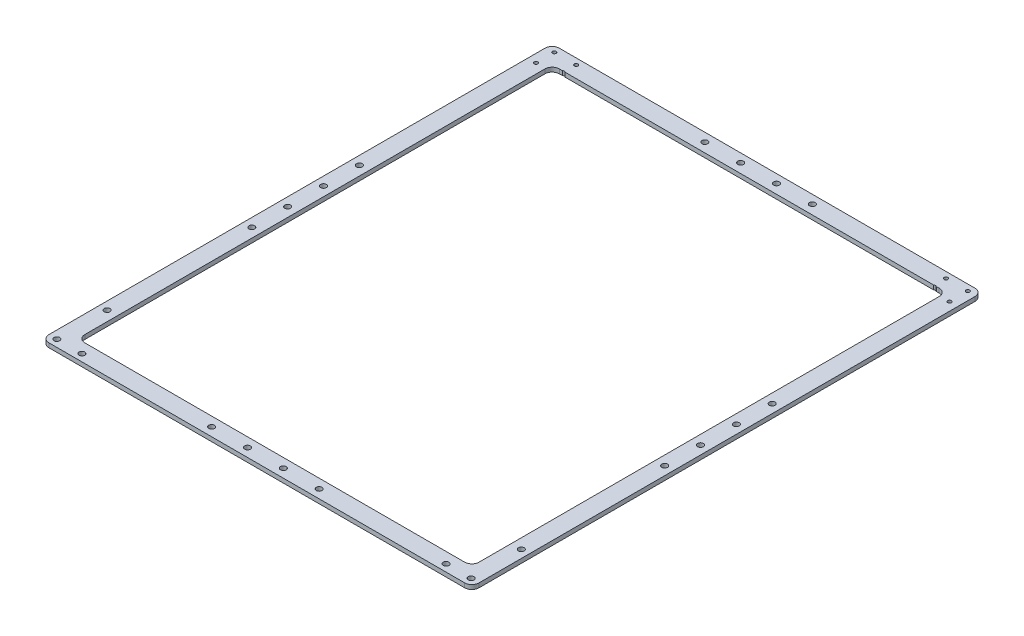
from build123d import *

# Parameters (mm, degrees)
SKETCH1_W                = 600
SKETCH1_H                = 730
BOSS_EXTRUDE1_DEPTH      = 6
SKETCH2_R                = 2.75
CUT_EXTRUDE1_DEPTH       = 473.505026428
LPATTERN1_COUNT          = 25
LPATTERN1_PITCH          = 25
MIRROR2_COPY_1_SKETCH_R  = 2.75
MIRROR2_COPY_1_DEPTH     = 473.505026428
MIRROR2_COPY_2_SKETCH_R  = 2.75
MIRROR2_COPY_2_DEPTH     = 473.505026428
MIRROR2_COPY_3_SKETCH_R  = 2.75
MIRROR2_COPY_3_DEPTH     = 473.505026428
MIRROR2_COPY_4_SKETCH_R  = 2.75
MIRROR2_COPY_4_DEPTH     = 473.505026428
MIRROR2_COPY_5_SKETCH_R  = 2.75
MIRROR2_COPY_5_DEPTH     = 473.505026428
MIRROR2_COPY_6_SKETCH_R  = 2.75
MIRROR2_COPY_6_DEPTH     = 473.505026428
MIRROR2_COPY_7_SKETCH_R  = 2.75
MIRROR2_COPY_7_DEPTH     = 473.505026428
MIRROR2_COPY_8_SKETCH_R  = 2.75
MIRROR2_COPY_8_DEPTH     = 473.505026428
MIRROR2_COPY_9_SKETCH_R  = 2.75
MIRROR2_COPY_9_DEPTH     = 473.505026428
MIRROR2_COPY_10_SKETCH_R = 2.75
MIRROR2_COPY_10_DEPTH    = 473.505026428
MIRROR2_COPY_11_SKETCH_R = 2.75
MIRROR2_COPY_11_DEPTH    = 473.505026428
MIRROR2_COPY_12_SKETCH_R = 2.75
MIRROR2_COPY_12_DEPTH    = 473.505026428
MIRROR2_COPY_13_SKETCH_R = 2.75
MIRROR2_COPY_13_DEPTH    = 473.505026428
MIRROR2_COPY_14_SKETCH_R = 2.75
MIRROR2_COPY_14_DEPTH    = 473.505026428
MIRROR2_COPY_15_SKETCH_R = 2.75
MIRROR2_COPY_15_DEPTH    = 473.505026428
MIRROR2_COPY_16_SKETCH_R = 2.75
MIRROR2_COPY_16_DEPTH    = 473.505026428
MIRROR2_COPY_17_SKETCH_R = 2.75
MIRROR2_COPY_17_DEPTH    = 473.505026428
MIRROR2_COPY_18_SKETCH_R = 2.75
MIRROR2_COPY_18_DEPTH    = 473.505026428
MIRROR2_COPY_19_SKETCH_R = 2.75
MIRROR2_COPY_19_DEPTH    = 473.505026428
MIRROR2_COPY_20_SKETCH_R = 2.75
MIRROR2_COPY_20_DEPTH    = 473.505026428
MIRROR2_COPY_21_SKETCH_R = 2.75
MIRROR2_COPY_21_DEPTH    = 473.505026428
MIRROR2_COPY_22_SKETCH_R = 2.75
MIRROR2_COPY_22_DEPTH    = 473.505026428
MIRROR2_COPY_23_SKETCH_R = 2.75
MIRROR2_COPY_23_DEPTH    = 473.505026428
MIRROR2_COPY_24_SKETCH_R = 2.75
MIRROR2_COPY_24_DEPTH    = 473.505026428
SKETCH3_R                = 4
CUT_EXTRUDE2_DEPTH       = 13
SKETCH5_R                = 2.55
CUT_EXTRUDE4_DEPTH       = 473.505026428
SKETCH6_W                = 600
SKETCH6_H                = 18
CUT_EXTRUDE5_DEPTH       = 6
CUT_EXTRUDE6_REACH       = 474.505
SKETCH7_R                = 4
CUT_EXTRUDE7_REACH       = 474.505
SKETCH8_R                = 4
CUT_EXTRUDE8_REACH       = 474.505
SKETCH9_W                = 550
SKETCH9_H                = 662
FILLET2_R                = 10


with BuildPart() as part:
    # Sketch1 → Boss-Extrude1 (new body)
    with BuildSketch(Plane(origin=(0, 0, 0), x_dir=(1, 0, 0), z_dir=(0, 1, 0))):
        Rectangle(SKETCH1_W, SKETCH1_H)
    extrude(amount=BOSS_EXTRUDE1_DEPTH)

    # Sketch2 → Cut-Extrude1 (cut, through all)
    with BuildSketch(Plane(origin=(0, 6, 0), x_dir=(1, 0, 0), z_dir=(0, 1, 0))):
        with Locations(Location((-259, 320, 0), (0, 0, 270))):
            Circle(SKETCH2_R)
    cut_extrude1 = extrude(amount=-CUT_EXTRUDE1_DEPTH, mode=Mode.SUBTRACT)

    # LPattern1: Cut-Extrude1 ×25
    with Locations(*[(0, 0, i * LPATTERN1_PITCH) for i in range(1, LPATTERN1_COUNT)]):
        add(cut_extrude1, mode=Mode.SUBTRACT)

    # Mirror2: Cut-Extrude1 across plane
    add(cut_extrude1.mirror(Plane(origin=(0, 0, 0), x_dir=(0, 0, 1), z_dir=(1, 0, 0))), mode=Mode.SUBTRACT)

    # Mirror2 copy 1 sketch → Mirror2 copy 1 (cut, through all)
    with BuildSketch(Plane(origin=(0, 6, 25), x_dir=(-1, 0, 0), z_dir=(0, 1, 0))):
        with Locations((-259, -320)):
            Circle(MIRROR2_COPY_1_SKETCH_R)
    extrude(amount=-MIRROR2_COPY_1_DEPTH, mode=Mode.SUBTRACT)

    # Mirror2 copy 2 sketch → Mirror2 copy 2 (cut, through all)
    with BuildSketch(Plane(origin=(0, 6, 50), x_dir=(-1, 0, 0), z_dir=(0, 1, 0))):
        with Locations((-259, -320)):
            Circle(MIRROR2_COPY_2_SKETCH_R)
    extrude(amount=-MIRROR2_COPY_2_DEPTH, mode=Mode.SUBTRACT)

    # Mirror2 copy 3 sketch → Mirror2 copy 3 (cut, through all)
    with BuildSketch(Plane(origin=(0, 6, 75), x_dir=(-1, 0, 0), z_dir=(0, 1, 0))):
        with Locations((-259, -320)):
            Circle(MIRROR2_COPY_3_SKETCH_R)
    extrude(amount=-MIRROR2_COPY_3_DEPTH, mode=Mode.SUBTRACT)

    # Mirror2 copy 4 sketch → Mirror2 copy 4 (cut, through all)
    with BuildSketch(Plane(origin=(0, 6, 100), x_dir=(-1, 0, 0), z_dir=(0, 1, 0))):
        with Locations((-259, -320)):
            Circle(MIRROR2_COPY_4_SKETCH_R)
    extrude(amount=-MIRROR2_COPY_4_DEPTH, mode=Mode.SUBTRACT)

    # Mirror2 copy 5 sketch → Mirror2 copy 5 (cut, through all)
    with BuildSketch(Plane(origin=(0, 6, 125), x_dir=(-1, 0, 0), z_dir=(0, 1, 0))):
        with Locations((-259, -320)):
            Circle(MIRROR2_COPY_5_SKETCH_R)
    extrude(amount=-MIRROR2_COPY_5_DEPTH, mode=Mode.SUBTRACT)

    # Mirror2 copy 6 sketch → Mirror2 copy 6 (cut, through all)
    with BuildSketch(Plane(origin=(0, 6, 150), x_dir=(-1, 0, 0), z_dir=(0, 1, 0))):
        with Locations((-259, -320)):
            Circle(MIRROR2_COPY_6_SKETCH_R)
    extrude(amount=-MIRROR2_COPY_6_DEPTH, mode=Mode.SUBTRACT)

    # Mirror2 copy 7 sketch → Mirror2 copy 7 (cut, through all)
    with BuildSketch(Plane(origin=(0, 6, 175), x_dir=(-1, 0, 0), z_dir=(0, 1, 0))):
        with Locations((-259, -320)):
            Circle(MIRROR2_COPY_7_SKETCH_R)
    extrude(amount=-MIRROR2_COPY_7_DEPTH, mode=Mode.SUBTRACT)

    # Mirror2 copy 8 sketch → Mirror2 copy 8 (cut, through all)
    with BuildSketch(Plane(origin=(0, 6, 200), x_dir=(-1, 0, 0), z_dir=(0, 1, 0))):
        with Locations((-259, -320)):
            Circle(MIRROR2_COPY_8_SKETCH_R)
    extrude(amount=-MIRROR2_COPY_8_DEPTH, mode=Mode.SUBTRACT)

    # Mirror2 copy 9 sketch → Mirror2 copy 9 (cut, through all)
    with BuildSketch(Plane(origin=(0, 6, 225), x_dir=(-1, 0, 0), z_dir=(0, 1, 0))):
        with Locations((-259, -320)):
            Circle(MIRROR2_COPY_9_SKETCH_R)
    extrude(amount=-MIRROR2_COPY_9_DEPTH, mode=Mode.SUBTRACT)

    # Mirror2 copy 10 sketch → Mirror2 copy 10 (cut, through all)
    with BuildSketch(Plane(origin=(0, 6, 250), x_dir=(-1, 0, 0), z_dir=(0, 1, 0))):
        with Locations((-259, -320)):
            Circle(MIRROR2_COPY_10_SKETCH_R)
    extrude(amount=-MIRROR2_COPY_10_DEPTH, mode=Mode.SUBTRACT)

    # Mirror2 copy 11 sketch → Mirror2 copy 11 (cut, through all)
    with BuildSketch(Plane(origin=(0, 6, 275), x_dir=(-1, 0, 0), z_dir=(0, 1, 0))):
        with Locations((-259, -320)):
            Circle(MIRROR2_COPY_11_SKETCH_R)
    extrude(amount=-MIRROR2_COPY_11_DEPTH, mode=Mode.SUBTRACT)

    # Mirror2 copy 12 sketch → Mirror2 copy 12 (cut, through all)
    with BuildSketch(Plane(origin=(0, 6, 300), x_dir=(-1, 0, 0), z_dir=(0, 1, 0))):
        with Locations((-259, -320)):
            Circle(MIRROR2_COPY_12_SKETCH_R)
    extrude(amount=-MIRROR2_COPY_12_DEPTH, mode=Mode.SUBTRACT)

    # Mirror2 copy 13 sketch → Mirror2 copy 13 (cut, through all)
    with BuildSketch(Plane(origin=(0, 6, 325), x_dir=(-1, 0, 0), z_dir=(0, 1, 0))):
        with Locations((-259, -320)):
            Circle(MIRROR2_COPY_13_SKETCH_R)
    extrude(amount=-MIRROR2_COPY_13_DEPTH, mode=Mode.SUBTRACT)

    # Mirror2 copy 14 sketch → Mirror2 copy 14 (cut, through all)
    with BuildSketch(Plane(origin=(0, 6, 350), x_dir=(-1, 0, 0), z_dir=(0, 1, 0))):
        with Locations((-259, -320)):
            Circle(MIRROR2_COPY_14_SKETCH_R)
    extrude(amount=-MIRROR2_COPY_14_DEPTH, mode=Mode.SUBTRACT)

    # Mirror2 copy 15 sketch → Mirror2 copy 15 (cut, through all)
    with BuildSketch(Plane(origin=(0, 6, 375), x_dir=(-1, 0, 0), z_dir=(0, 1, 0))):
        with Locations((-259, -320)):
            Circle(MIRROR2_COPY_15_SKETCH_R)
    extrude(amount=-MIRROR2_COPY_15_DEPTH, mode=Mode.SUBTRACT)

    # Mirror2 copy 16 sketch → Mirror2 copy 16 (cut, through all)
    with BuildSketch(Plane(origin=(0, 6, 400), x_dir=(-1, 0, 0), z_dir=(0, 1, 0))):
        with Locations((-259, -320)):
            Circle(MIRROR2_COPY_16_SKETCH_R)
    extrude(amount=-MIRROR2_COPY_16_DEPTH, mode=Mode.SUBTRACT)

    # Mirror2 copy 17 sketch → Mirror2 copy 17 (cut, through all)
    with BuildSketch(Plane(origin=(0, 6, 425), x_dir=(-1, 0, 0), z_dir=(0, 1, 0))):
        with Locations((-259, -320)):
            Circle(MIRROR2_COPY_17_SKETCH_R)
    extrude(amount=-MIRROR2_COPY_17_DEPTH, mode=Mode.SUBTRACT)

    # Mirror2 copy 18 sketch → Mirror2 copy 18 (cut, through all)
    with BuildSketch(Plane(origin=(0, 6, 450), x_dir=(-1, 0, 0), z_dir=(0, 1, 0))):
        with Locations((-259, -320)):
            Circle(MIRROR2_COPY_18_SKETCH_R)
    extrude(amount=-MIRROR2_COPY_18_DEPTH, mode=Mode.SUBTRACT)

    # Mirror2 copy 19 sketch → Mirror2 copy 19 (cut, through all)
    with BuildSketch(Plane(origin=(0, 6, 475), x_dir=(-1, 0, 0), z_dir=(0, 1, 0))):
        with Locations((-259, -320)):
            Circle(MIRROR2_COPY_19_SKETCH_R)
    extrude(amount=-MIRROR2_COPY_19_DEPTH, mode=Mode.SUBTRACT)

    # Mirror2 copy 20 sketch → Mirror2 copy 20 (cut, through all)
    with BuildSketch(Plane(origin=(0, 6, 500), x_dir=(-1, 0, 0), z_dir=(0, 1, 0))):
        with Locations((-259, -320)):
            Circle(MIRROR2_COPY_20_SKETCH_R)
    extrude(amount=-MIRROR2_COPY_20_DEPTH, mode=Mode.SUBTRACT)

    # Mirror2 copy 21 sketch → Mirror2 copy 21 (cut, through all)
    with BuildSketch(Plane(origin=(0, 6, 525), x_dir=(-1, 0, 0), z_dir=(0, 1, 0))):
        with Locations((-259, -320)):
            Circle(MIRROR2_COPY_21_SKETCH_R)
    extrude(amount=-MIRROR2_COPY_21_DEPTH, mode=Mode.SUBTRACT)

    # Mirror2 copy 22 sketch → Mirror2 copy 22 (cut, through all)
    with BuildSketch(Plane(origin=(0, 6, 550), x_dir=(-1, 0, 0), z_dir=(0, 1, 0))):
        with Locations((-259, -320)):
            Circle(MIRROR2_COPY_22_SKETCH_R)
    extrude(amount=-MIRROR2_COPY_22_DEPTH, mode=Mode.SUBTRACT)

    # Mirror2 copy 23 sketch → Mirror2 copy 23 (cut, through all)
    with BuildSketch(Plane(origin=(0, 6, 575), x_dir=(-1, 0, 0), z_dir=(0, 1, 0))):
        with Locations((-259, -320)):
            Circle(MIRROR2_COPY_23_SKETCH_R)
    extrude(amount=-MIRROR2_COPY_23_DEPTH, mode=Mode.SUBTRACT)

    # Mirror2 copy 24 sketch → Mirror2 copy 24 (cut, through all)
    with BuildSketch(Plane(origin=(0, 6, 600), x_dir=(-1, 0, 0), z_dir=(0, 1, 0))):
        with Locations((-259, -320)):
            Circle(MIRROR2_COPY_24_SKETCH_R)
    extrude(amount=-MIRROR2_COPY_24_DEPTH, mode=Mode.SUBTRACT)

    # Sketch3 → Cut-Extrude2 (cut)
    with BuildSketch(Plane(origin=(0, 6, 0), x_dir=(1, 0, 0), z_dir=(0, 1, 0))):
        with Locations(Location((-289, -285, 0), (0, 0, 270))):
            Circle(SKETCH3_R)
        with Locations(Location((-254, -355, 0), (0, 0, 270))):
            Circle(SKETCH3_R)
        with Locations(Location((-289, -355, 0), (0, 0, 270))):
            Circle(SKETCH3_R)
        with Locations(Location((-236.98, -302.5, 0), (0, 0, 270))):
            Circle(SKETCH3_R)
    cut_extrude2 = extrude(amount=-CUT_EXTRUDE2_DEPTH, mode=Mode.SUBTRACT)

    # Mirror3: Cut-Extrude2 across plane
    add(cut_extrude2.mirror(Plane(origin=(0, 0, 0), x_dir=(0, 0, 1), z_dir=(1, 0, 0))), mode=Mode.SUBTRACT)

    # Sketch5 → Cut-Extrude4 (cut, through all)
    with BuildSketch(Plane(origin=(0, 6, 0), x_dir=(1, 0, 0), z_dir=(0, 1, 0))):
        with Locations(Location((-288.48, 313, 0), (0, 0, 270))):
            Circle(SKETCH5_R)
        with Locations(Location((-257.98, 338.5, 0), (0, 0, 270))):
            Circle(SKETCH5_R)
        with Locations(Location((-288.48, 338.5, 0), (0, 0, 270))):
            Circle(SKETCH5_R)
    cut_extrude4 = extrude(amount=-CUT_EXTRUDE4_DEPTH, mode=Mode.SUBTRACT)

    # Mirror5: Cut-Extrude4 across plane
    add(cut_extrude4.mirror(Plane(origin=(0, 0, 0), x_dir=(0, 0, 1), z_dir=(1, 0, 0))), mode=Mode.SUBTRACT)

    # Sketch6 → Cut-Extrude5 (cut)
    with BuildSketch(Plane(origin=(0, 6, 0), x_dir=(1, 0, 0), z_dir=(0, 1, 0))):
        with Locations((0, 356)):
            Rectangle(SKETCH6_W, SKETCH6_H)
    extrude(amount=-CUT_EXTRUDE5_DEPTH, mode=Mode.SUBTRACT)

    # Sketch7 → Cut-Extrude6 (cut, up to next)
    with BuildSketch(Plane(origin=(0, 6, 0), x_dir=(1, 0, 0), z_dir=(0, 1, 0)), mode=Mode.PRIVATE) as cut_extrude6_sk1:
        with Locations(Location((-75, 335, 0), (0, 0, 270))):
            Circle(SKETCH7_R)
    cut_extrude6_tool1 = extrude(cut_extrude6_sk1.sketch, amount=-CUT_EXTRUDE6_REACH, mode=Mode.PRIVATE) & part.part
    # Sketch7 → Cut-Extrude6 (cut, up to next)
    with BuildSketch(Plane(origin=(0, 6, 0), x_dir=(1, 0, 0), z_dir=(0, 1, 0)), mode=Mode.PRIVATE) as cut_extrude6_sk2:
        with Locations(Location((-25, 335, 0), (0, 0, 270))):
            Circle(SKETCH7_R)
    cut_extrude6_tool2 = extrude(cut_extrude6_sk2.sketch, amount=-CUT_EXTRUDE6_REACH, mode=Mode.PRIVATE) & part.part
    # Sketch7 → Cut-Extrude6 (cut, up to next)
    with BuildSketch(Plane(origin=(0, 6, 0), x_dir=(1, 0, 0), z_dir=(0, 1, 0)), mode=Mode.PRIVATE) as cut_extrude6_sk3:
        with Locations(Location((25, 335, 0), (0, 0, 270))):
            Circle(SKETCH7_R)
    cut_extrude6_tool3 = extrude(cut_extrude6_sk3.sketch, amount=-CUT_EXTRUDE6_REACH, mode=Mode.PRIVATE) & part.part
    # Sketch7 → Cut-Extrude6 (cut, up to next)
    with BuildSketch(Plane(origin=(0, 6, 0), x_dir=(1, 0, 0), z_dir=(0, 1, 0)), mode=Mode.PRIVATE) as cut_extrude6_sk4:
        with Locations(Location((75, 335, 0), (0, 0, 270))):
            Circle(SKETCH7_R)
    cut_extrude6_tool4 = extrude(cut_extrude6_sk4.sketch, amount=-CUT_EXTRUDE6_REACH, mode=Mode.PRIVATE) & part.part
    # Sketch7 → Cut-Extrude6 (cut, up to next)
    with BuildSketch(Plane(origin=(0, 6, 0), x_dir=(1, 0, 0), z_dir=(0, 1, 0)), mode=Mode.PRIVATE) as cut_extrude6_sk5:
        with Locations(Location((75, -353, 0), (0, 0, 90))):
            Circle(SKETCH7_R)
    cut_extrude6_tool5 = extrude(cut_extrude6_sk5.sketch, amount=-CUT_EXTRUDE6_REACH, mode=Mode.PRIVATE) & part.part
    # Sketch7 → Cut-Extrude6 (cut, up to next)
    with BuildSketch(Plane(origin=(0, 6, 0), x_dir=(1, 0, 0), z_dir=(0, 1, 0)), mode=Mode.PRIVATE) as cut_extrude6_sk6:
        with Locations(Location((25, -353, 0), (0, 0, 90))):
            Circle(SKETCH7_R)
    cut_extrude6_tool6 = extrude(cut_extrude6_sk6.sketch, amount=-CUT_EXTRUDE6_REACH, mode=Mode.PRIVATE) & part.part
    # Sketch7 → Cut-Extrude6 (cut, up to next)
    with BuildSketch(Plane(origin=(0, 6, 0), x_dir=(1, 0, 0), z_dir=(0, 1, 0)), mode=Mode.PRIVATE) as cut_extrude6_sk7:
        with Locations(Location((-25, -353, 0), (0, 0, 90))):
            Circle(SKETCH7_R)
    cut_extrude6_tool7 = extrude(cut_extrude6_sk7.sketch, amount=-CUT_EXTRUDE6_REACH, mode=Mode.PRIVATE) & part.part
    # Sketch7 → Cut-Extrude6 (cut, up to next)
    with BuildSketch(Plane(origin=(0, 6, 0), x_dir=(1, 0, 0), z_dir=(0, 1, 0)), mode=Mode.PRIVATE) as cut_extrude6_sk8:
        with Locations(Location((-75, -353, 0), (0, 0, 90))):
            Circle(SKETCH7_R)
    cut_extrude6_tool8 = extrude(cut_extrude6_sk8.sketch, amount=-CUT_EXTRUDE6_REACH, mode=Mode.PRIVATE) & part.part
    add(cut_extrude6_tool1.solids().sort_by_distance((-75, 6, -335))[0], mode=Mode.SUBTRACT)
    add(cut_extrude6_tool2.solids().sort_by_distance((-25, 6, -335))[0], mode=Mode.SUBTRACT)
    add(cut_extrude6_tool3.solids().sort_by_distance((25, 6, -335))[0], mode=Mode.SUBTRACT)
    add(cut_extrude6_tool4.solids().sort_by_distance((75, 6, -335))[0], mode=Mode.SUBTRACT)
    add(cut_extrude6_tool5.solids().sort_by_distance((75, 6, 353))[0], mode=Mode.SUBTRACT)
    add(cut_extrude6_tool6.solids().sort_by_distance((25, 6, 353))[0], mode=Mode.SUBTRACT)
    add(cut_extrude6_tool7.solids().sort_by_distance((-25, 6, 353))[0], mode=Mode.SUBTRACT)
    add(cut_extrude6_tool8.solids().sort_by_distance((-75, 6, 353))[0], mode=Mode.SUBTRACT)

    # Sketch8 → Cut-Extrude7 (cut, up to next)
    with BuildSketch(Plane(origin=(0, 6, 0), x_dir=(1, 0, 0), z_dir=(0, 1, 0)), mode=Mode.PRIVATE) as cut_extrude7_sk1:
        with Locations(Location((288, 66, 0), (0, 0, 270))):
            Circle(SKETCH8_R)
    cut_extrude7_tool1 = extrude(cut_extrude7_sk1.sketch, amount=-CUT_EXTRUDE7_REACH, mode=Mode.PRIVATE) & part.part
    # Sketch8 → Cut-Extrude7 (cut, up to next)
    with BuildSketch(Plane(origin=(0, 6, 0), x_dir=(1, 0, 0), z_dir=(0, 1, 0)), mode=Mode.PRIVATE) as cut_extrude7_sk2:
        with Locations(Location((288, 16, 0), (0, 0, 270))):
            Circle(SKETCH8_R)
    cut_extrude7_tool2 = extrude(cut_extrude7_sk2.sketch, amount=-CUT_EXTRUDE7_REACH, mode=Mode.PRIVATE) & part.part
    # Sketch8 → Cut-Extrude7 (cut, up to next)
    with BuildSketch(Plane(origin=(0, 6, 0), x_dir=(1, 0, 0), z_dir=(0, 1, 0)), mode=Mode.PRIVATE) as cut_extrude7_sk3:
        with Locations(Location((288, -34, 0), (0, 0, 270))):
            Circle(SKETCH8_R)
    cut_extrude7_tool3 = extrude(cut_extrude7_sk3.sketch, amount=-CUT_EXTRUDE7_REACH, mode=Mode.PRIVATE) & part.part
    # Sketch8 → Cut-Extrude7 (cut, up to next)
    with BuildSketch(Plane(origin=(0, 6, 0), x_dir=(1, 0, 0), z_dir=(0, 1, 0)), mode=Mode.PRIVATE) as cut_extrude7_sk4:
        with Locations(Location((288, -84, 0), (0, 0, 270))):
            Circle(SKETCH8_R)
    cut_extrude7_tool4 = extrude(cut_extrude7_sk4.sketch, amount=-CUT_EXTRUDE7_REACH, mode=Mode.PRIVATE) & part.part
    cut_extrude7_1 = cut_extrude7_tool1.solids().sort_by_distance((288, 6, -66))[0]
    add(cut_extrude7_1, mode=Mode.SUBTRACT)
    cut_extrude7_2 = cut_extrude7_tool2.solids().sort_by_distance((288, 6, -16))[0]
    add(cut_extrude7_2, mode=Mode.SUBTRACT)
    cut_extrude7_3 = cut_extrude7_tool3.solids().sort_by_distance((288, 6, 34))[0]
    add(cut_extrude7_3, mode=Mode.SUBTRACT)
    cut_extrude7_4 = cut_extrude7_tool4.solids().sort_by_distance((288, 6, 84))[0]
    add(cut_extrude7_4, mode=Mode.SUBTRACT)
    cut_extrude7 = cut_extrude7_1 + cut_extrude7_2 + cut_extrude7_3 + cut_extrude7_4  # Cut-Extrude7 as one shape, for the pattern or mirror that repeats it

    # Mirror6: Cut-Extrude7 across plane
    add(cut_extrude7.mirror(Plane(origin=(0, 0, 0), x_dir=(0, 0, 1), z_dir=(1, 0, 0))), mode=Mode.SUBTRACT)

    # Sketch9 → Cut-Extrude8 (cut, up to next)
    with BuildSketch(Plane(origin=(0, 6, 0), x_dir=(1, 0, 0), z_dir=(0, 1, 0)), mode=Mode.PRIVATE) as cut_extrude8_sk1:
        with Locations((0, -9)):
            Rectangle(SKETCH9_W, SKETCH9_H)
    cut_extrude8_tool1 = extrude(cut_extrude8_sk1.sketch, amount=-CUT_EXTRUDE8_REACH, mode=Mode.PRIVATE) & part.part
    add(cut_extrude8_tool1.solids().sort_by_distance((0, 6, 9))[0], mode=Mode.SUBTRACT)

    # Fillet2
    fillet2_edges = [part.edges().sort_by_distance(p)[0] for p in [
        (-300, 3, -347),
        (300, 3, -347),
        (-275, 3, -322),
        (275, 3, -322),
        (275, 3, 340),
        (-275, 3, 340),
        (300, 3, 365),
        (-300, 3, 365),
    ]]
    fillet(fillet2_edges, radius=FILLET2_R)


solid = part.part
